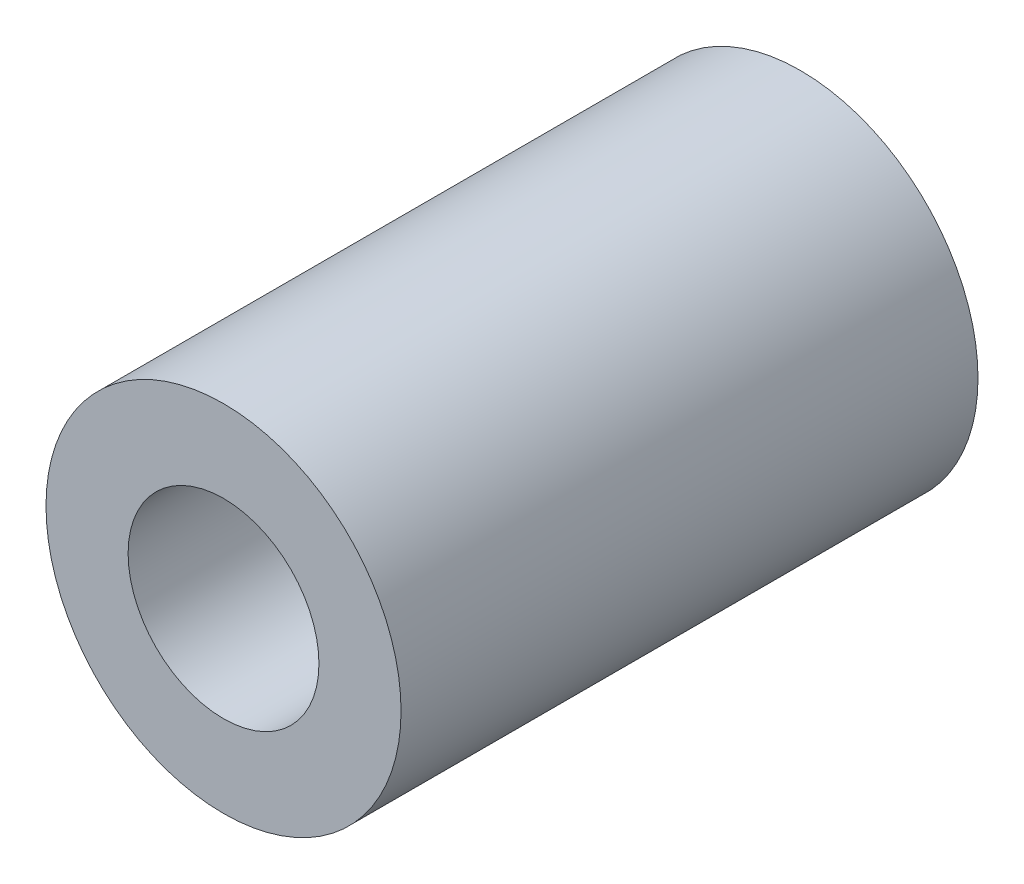
from build123d import *

# Parameters (mm, degrees)
SPACER_BETWEEN_POM_MOUNTING_EARS_PROFILE_R   = 4
SPACER_BETWEEN_POM_MOUNTING_EARS_PROFILE_R_2 = 2.15
SPACER_BETWEEN_POM_MOUNTING_EARS_DEPTH       = 13


with BuildPart() as part:
    # Spacer_between_POM_mounting_ears_profile → Spacer_between_POM_mounting_ears (new body)
    with BuildSketch(Plane.XY):
        with Locations(Location((0, 0, 0), (0, 0, 180))):
            Circle(SPACER_BETWEEN_POM_MOUNTING_EARS_PROFILE_R)
        with Locations(Location((0, 0, 0), (0, 0, 180))):
            Circle(SPACER_BETWEEN_POM_MOUNTING_EARS_PROFILE_R_2, mode=Mode.SUBTRACT)
    extrude(amount=SPACER_BETWEEN_POM_MOUNTING_EARS_DEPTH)


solid = part.part
